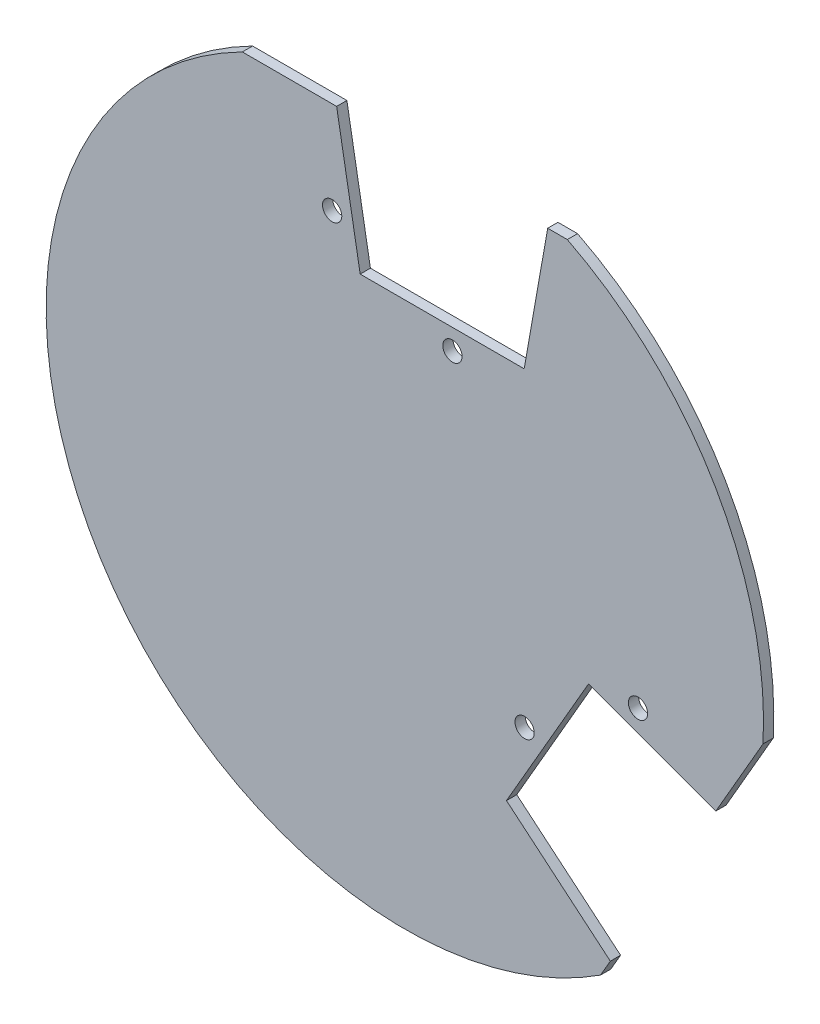
from build123d import *

# Parameters (mm, degrees)
ESQUISSE1_R             = 175
BOSS_EXTRU_1_DEPTH      = 5
ESQUISSE2_R             = 4.7
ENL_V_MAT_EXTRU_1_DEPTH = 5


with BuildPart() as part:
    # Esquisse1 → Boss.-Extru.1 (new body)
    with BuildSketch(Plane.XY):
        Circle(ESQUISSE1_R)
    extrude(amount=BOSS_EXTRU_1_DEPTH)

    # Esquisse2 → Enlèv. mat.-Extru.1 (cut)
    with BuildSketch(Plane(origin=(0, 0, 0), x_dir=(-1, 0, 0), z_dir=(0, 0, -1))):
        with Locations((-23.220426897, 80.887612711)):
            Circle(ESQUISSE2_R)
        with Locations((35.460378836, 110.887612711)):
            Circle(ESQUISSE2_R)
        with Locations((-58.440514011, -60.553285934)):
            Circle(ESQUISSE2_R)
        with Locations((-113.761678991, -24.734217455)):
            Circle(ESQUISSE2_R)
        Polygon((21.779573103, 90.887612711), (33.263317057, 156.015161015), (79.273384773, 156.015161015), (79.273384773, 185.246123659), (-115.714238566, 185.246123659), (-115.714238566, 156.015161015), (-69.70417085, 156.015161015), (-58.220426897, 90.887612711), align=None)
        Polygon((-89.600768048, -26.582142764), (-151.744751343, -49.200702922), (-174.749785201, -9.35481545), (-200.064541428, -23.970296772), (-102.570729758, -192.834532007), (-77.255973531, -178.219050686), (-100.26100739, -138.373163213), (-49.600768048, -95.864175067), align=None)
    extrude(amount=-ENL_V_MAT_EXTRU_1_DEPTH, mode=Mode.SUBTRACT)


solid = part.part
